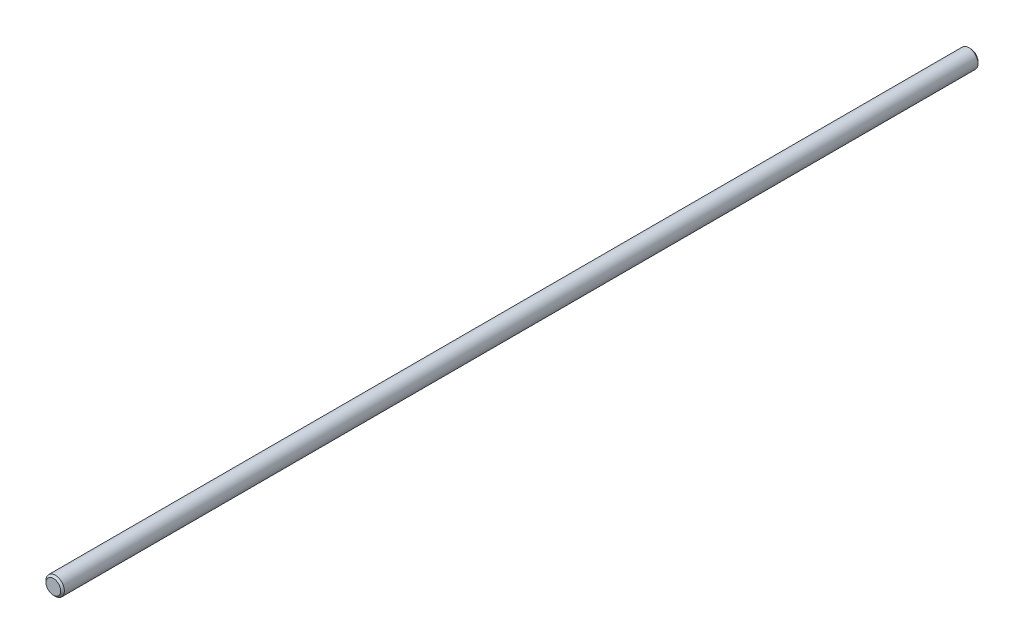
from build123d import *

# Parameters (mm, degrees)
SKETCH1_R      = 10
EXTRUDE1_DEPTH = 500
CHAMFER1_SIZE  = 2


with BuildPart() as part:
    # Sketch1 → Extrude1 (new, symmetric)
    with BuildSketch(Plane.XY):
        Circle(SKETCH1_R)
    extrude(amount=EXTRUDE1_DEPTH, both=True)

    # Chamfer1
    chamfer1_edges = [part.edges().sort_by_distance(p)[0] for p in [
        (-10, 0, -500),
        (-10, 0, 500),
    ]]
    chamfer(chamfer1_edges, length=CHAMFER1_SIZE)


solid = part.part
